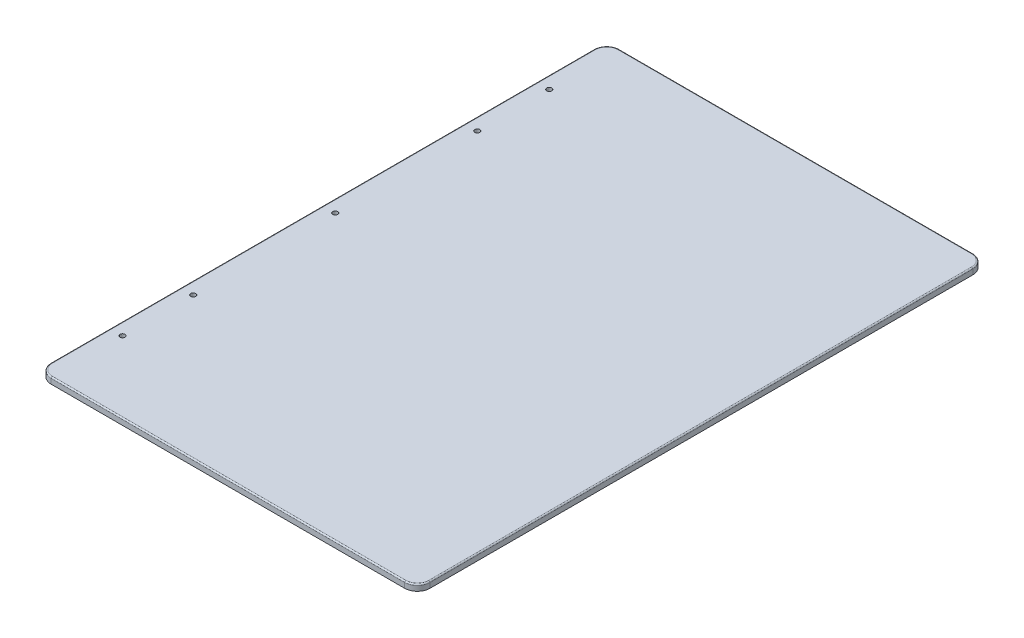
from build123d import *

# Parameters (mm, degrees)
SKETCH1_W           = 300
SKETCH1_H           = 450
BOSS_EXTRUDE1_DEPTH = 5
SKETCH2_R           = 2
CUT_EXTRUDE1_DEPTH  = 271.462566726
FILLET2_R           = 10
FILLET1_R           = 1
SKETCH4_W           = 10
SKETCH4_H           = 410
CUT_EXTRUDE3_DEPTH  = 0.5


with BuildPart() as part:
    # Sketch1 → Boss-Extrude1 (new body)
    with BuildSketch(Plane(origin=(0, 0, 0), x_dir=(1, 0, 0), z_dir=(0, 1, 0))):
        Rectangle(SKETCH1_W, SKETCH1_H)
    extrude(amount=BOSS_EXTRUDE1_DEPTH)

    # Sketch2 → Cut-Extrude1 (cut, through all)
    with BuildSketch(Plane(origin=(0, 5, 0), x_dir=(1, 0, 0), z_dir=(0, 1, 0))):
        with Locations(Location((-140, 0, 0), (0, 0, 270))):
            Circle(SKETCH2_R)
        with Locations(Location((-140, 112.5, 0), (0, 0, 270))):
            Circle(SKETCH2_R)
        with Locations(Location((-140, -112.5, 0), (0, 0, 270))):
            Circle(SKETCH2_R)
        with Locations(Location((-140, 169.5, 0), (0, 0, 270))):
            Circle(SKETCH2_R)
        with Locations(Location((-140, -168.5, 0), (0, 0, 270))):
            Circle(SKETCH2_R)
    extrude(amount=-CUT_EXTRUDE1_DEPTH, mode=Mode.SUBTRACT)

    # Fillet2
    fillet2_edges = [part.edges().sort_by_distance(p)[0] for p in [
        (150, 2.5, 225),
        (-150, 2.5, 225),
        (-150, 2.5, -225),
        (150, 2.5, -225),
    ]]
    fillet(fillet2_edges, radius=FILLET2_R)

    # Fillet1
    fillet1_edges = [part.edges().sort_by_distance(p)[0] for p in [
        (-150, 5, 0),
        (0, 5, -225),
        (150, 5, 0),
        (0, 5, 225),
        (-147.071067812, 5, 222.071067812),
        (147.071067812, 5, 222.071067812),
        (147.071067812, 5, -222.071067812),
        (-147.071067812, 5, -222.071067812),
    ]]
    fillet(fillet1_edges, radius=FILLET1_R)

    # Sketch4 → Cut-Extrude3 (cut)
    with BuildSketch(Plane.XZ):
        with Locations((20, 0)):
            Rectangle(SKETCH4_W, SKETCH4_H)
        Rectangle(SKETCH4_W, SKETCH4_H)
        with Locations((40, 0)):
            Rectangle(SKETCH4_W, SKETCH4_H)
        with Locations((60, 0)):
            Rectangle(SKETCH4_W, SKETCH4_H)
        with Locations((80, 0)):
            Rectangle(SKETCH4_W, SKETCH4_H)
        with Locations((100, 0)):
            Rectangle(SKETCH4_W, SKETCH4_H)
        with Locations((-20, 0)):
            Rectangle(SKETCH4_W, SKETCH4_H)
        with Locations((-40, 0)):
            Rectangle(SKETCH4_W, SKETCH4_H)
        with Locations((-60, 0)):
            Rectangle(SKETCH4_W, SKETCH4_H)
        with Locations((-80, 0)):
            Rectangle(SKETCH4_W, SKETCH4_H)
        with Locations((-100, 0)):
            Rectangle(SKETCH4_W, SKETCH4_H)
    extrude(amount=-CUT_EXTRUDE3_DEPTH, mode=Mode.SUBTRACT)


solid = part.part
